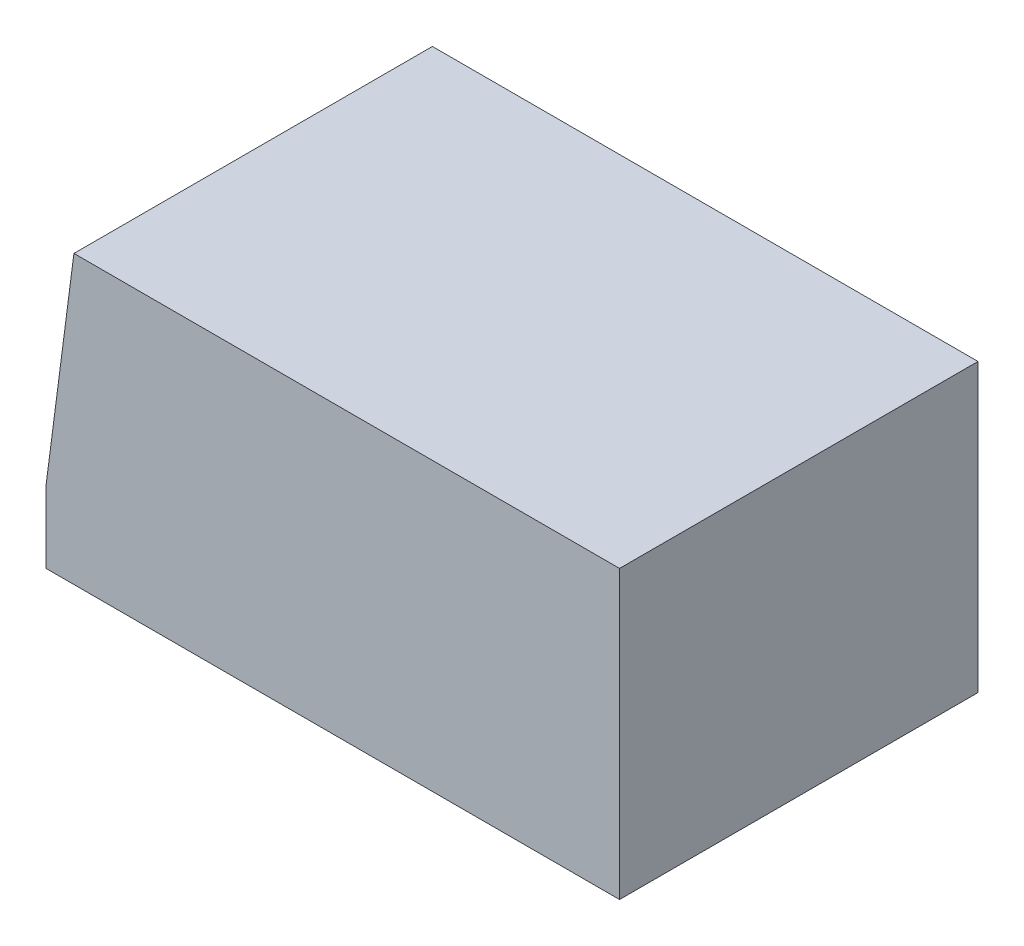
from build123d import *

# Parameters (mm, degrees)
ESQUISSE1_W             = 80
ESQUISSE1_H             = 50
BOSS_EXTRU_1_DEPTH      = 40
CHANFREIN1_SIZE         = 30
CHANFREIN1_SIZE2        = 3.896319712
ESQUISSE2_R             = 12.5
ENL_V_MAT_EXTRU_1_DEPTH = 40


with BuildPart() as part:
    # Esquisse1 → Boss.-Extru.1 (new body)
    with BuildSketch(Plane(origin=(0, 0, 0), x_dir=(1, 0, 0), z_dir=(0, 1, 0))):
        Rectangle(ESQUISSE1_W, ESQUISSE1_H)
    extrude(amount=BOSS_EXTRU_1_DEPTH)

    # Chanfrein1
    chanfrein1_edges = [part.edges().sort_by_distance(p)[0] for p in [
        (-40, 40, 0),
    ]]
    chanfrein1_side = [part.faces().sort_by_distance(p)[0] for p in [
        (-40, 20, 0),
    ]]
    chamfer(chanfrein1_edges, length=CHANFREIN1_SIZE, length2=CHANFREIN1_SIZE2, reference=chanfrein1_side[0])

    # Esquisse2 → Enlèv. mat.-Extru.1 (cut)
    with BuildSketch(Plane(origin=(-40.613696562, 5.274798216, 0), x_dir=(0, 0, 1), z_dir=(-0.9916711623830908, 0.12879559657755957, 0))):
        with Locations(Location((0, 18.912574177, 0), (0, 0, 270))):
            Circle(ESQUISSE2_R)
    extrude(amount=-ENL_V_MAT_EXTRU_1_DEPTH, mode=Mode.SUBTRACT)


solid = part.part
